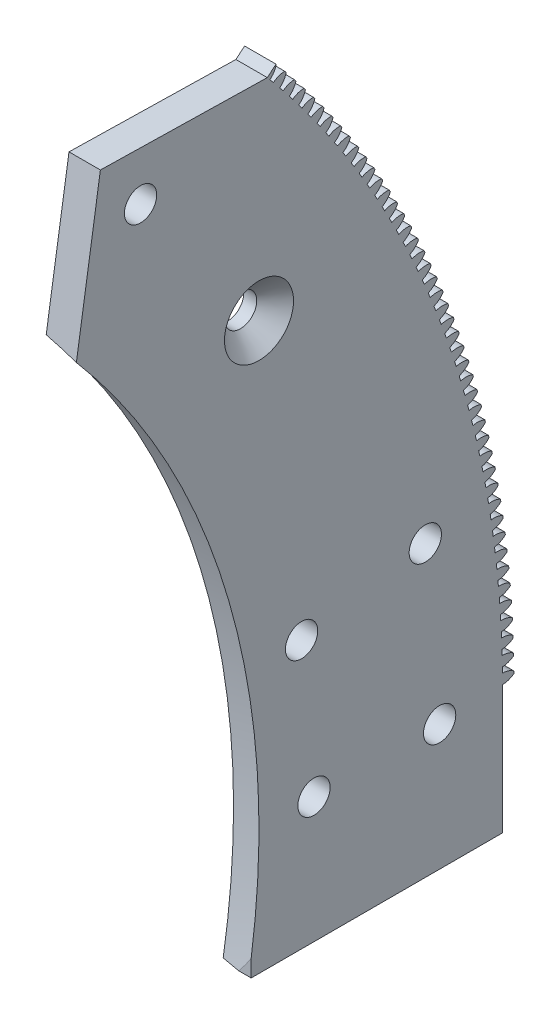
from build123d import *

# Parameters (mm, degrees)
BOSS_EXTRUDE2_DEPTH = 6.35
BOSS_EXTRUDE3_START = 6.35
BOSS_EXTRUDE3_DEPTH = 6.35
CUT_EXTRUDE4_DEPTH  = 6.35
CIRPATTERN3_COUNT   = 100
CIRPATTERN3_ANGLE   = 87.139364303
SKETCH2_R           = 3.2639
CUT_EXTRUDE5_DEPTH  = 6.35
SKETCH3_R           = 3.2639
CUT_EXTRUDE6_DEPTH  = 6.35
SKETCH15_R          = 3.2639
CUT_EXTRUDE7_DEPTH  = 245.371308652


with BuildPart() as part:
    # Sketch11 → Boss-Extrude2 (new body)
    with BuildSketch(Plane(origin=(6.35, 0, 0), x_dir=(0, 0, -1), z_dir=(1, 0, 0))):
        with BuildLine():
            Line((203.2, 0), (205.500006576, 0))
            ThreePointArc((205.500006576, 0), (193.106839751, 70.285141703), (157.422138098, 132.092858018))
            Line((157.422138098, 132.092858018), (155.660230842, 130.614442288))
            ThreePointArc((155.660230842, 130.614442288), (190.945540544, 69.498493124), (203.2, 0))
        make_face()
    extrude(amount=-BOSS_EXTRUDE2_DEPTH)

    # Sketch1 → Boss-Extrude3 (add)
    with BuildSketch(Plane(origin=(0, 0, 0), x_dir=(0, 0, -1), z_dir=(1, 0, 0)).offset(BOSS_EXTRUDE3_START)):
        with BuildLine():
            Line((152.4, 0), (152.4, -25.4))
            Line((152.4, -25.4), (203.2, -25.4))
            Line((203.2, -25.4), (203.2, 0))
            ThreePointArc((203.2, 0), (190.945540544, 69.498493124), (155.660230842, 130.614442288))
            Line((155.660230842, 130.614442288), (121.916747361, 131.312974751))
            Line((121.916747361, 131.312974751), (116.745173131, 97.960831716))
            ThreePointArc((116.745173131, 97.960831716), (143.209155408, 52.123869843), (152.4, 0))
        make_face()
    extrude(amount=-BOSS_EXTRUDE3_DEPTH)

    # Sketch12 → Cut-Extrude4 (cut)
    with BuildSketch(Plane(origin=(6.35, 0, 0), x_dir=(0, 0, -1), z_dir=(1, 0, 0))):
        with BuildLine():
            ThreePointArc((203.199243498, 0.554474368), (205.09127366, 1.060489201), (206.485639768, 2.43583363))
            ThreePointArc((206.485639768, 2.43583363), (206.496414843, 1.217937999), (206.500006576, 0))
            ThreePointArc((206.500006576, 0), (206.496414843, -1.217937999), (206.485639768, -2.43583363))
            ThreePointArc((206.485639768, -2.43583363), (205.09127366, -1.060489201), (203.199243498, -0.554474368))
            ThreePointArc((203.199243498, -0.554474368), (203.2, 0), (203.199243498, 0.554474368))
        make_face()
    cut_extrude4 = extrude(amount=-CUT_EXTRUDE4_DEPTH, mode=Mode.SUBTRACT)

    # CirPattern3: Cut-Extrude4 ×100 about axis
    cirpattern3_axis = Axis((0, 0, 0), (1, 0, 0))
    for i in range(1, CIRPATTERN3_COUNT):
        add(cut_extrude4.rotate(cirpattern3_axis, i * CIRPATTERN3_ANGLE / (CIRPATTERN3_COUNT - 1)), mode=Mode.SUBTRACT)

    # Sketch2 → Cut-Extrude5 (cut)
    with BuildSketch(Plane(origin=(6.35, 0, 0), x_dir=(0, 0, -1), z_dir=(1, 0, 0))):
        with Locations((165.1, 0)):
            Circle(SKETCH2_R)
        with Locations((190.5, 0)):
            Circle(SKETCH2_R)
        with Locations((162.591760022, 28.669314133)):
            Circle(SKETCH2_R)
        with Locations((187.605876949, 33.079977846)):
            Circle(SKETCH2_R)
    extrude(amount=-CUT_EXTRUDE5_DEPTH, mode=Mode.SUBTRACT)

    # Sketch3 → Cut-Extrude6 (cut)
    with BuildSketch(Plane(origin=(6.35, 0, 0), x_dir=(0, 0, -1), z_dir=(1, 0, 0))):
        with Locations((153.979316793, 88.9)):
            Circle(SKETCH3_R)
    extrude(amount=-CUT_EXTRUDE6_DEPTH, mode=Mode.SUBTRACT)

    # Sketch15 → Cut-Extrude7 (cut, through all)
    with BuildSketch(Plane(origin=(6.35, 0, 0), x_dir=(0, 0, -1), z_dir=(1, 0, 0))):
        with Locations((130.034688148, 121.259308419)):
            Circle(SKETCH15_R)
    extrude(amount=-CUT_EXTRUDE7_DEPTH, mode=Mode.SUBTRACT)

    # Sketch18 → Cut-Revolve3 (revolve, cut)
    with BuildSketch(Plane(origin=(0, 0, 0), x_dir=(-1, 0, 0), z_dir=(0, -0.866025403784438, -0.5000000000000012)), mode=Mode.PRIVATE) as cut_revolve3_sk:
        Polygon((-6.35, 177.8), (-6.35, 184.785), (0.635, 177.8), align=None)
    revolve(cut_revolve3_sk.sketch.rotate(Axis((1006.35, 88.9, -153.979316793), (-1, 0, 0)), 30), axis=Axis((1006.35, 88.9, -153.979316793), (-1, 0, 0)), mode=Mode.SUBTRACT)

    # Sketch21 → Cut-Revolve7 (revolve, cut)
    with BuildSketch(Plane(origin=(0, 0, 0), x_dir=(1, 0, 0), z_dir=(0, 1, 0))):
        with BuildLine():
            Line((-19.05, 38.1), (-137.677789746, 38.1))
            ThreePointArc((-137.677789746, 38.1), (-19.05, 156.727789746), (99.577789746, 38.1))
            Line((99.577789746, 38.1), (-19.05, 38.1))
        make_face()
    revolve(axis=Axis((-1000, 0, 0), (1, 0, 0)), mode=Mode.SUBTRACT)


solid = part.part
